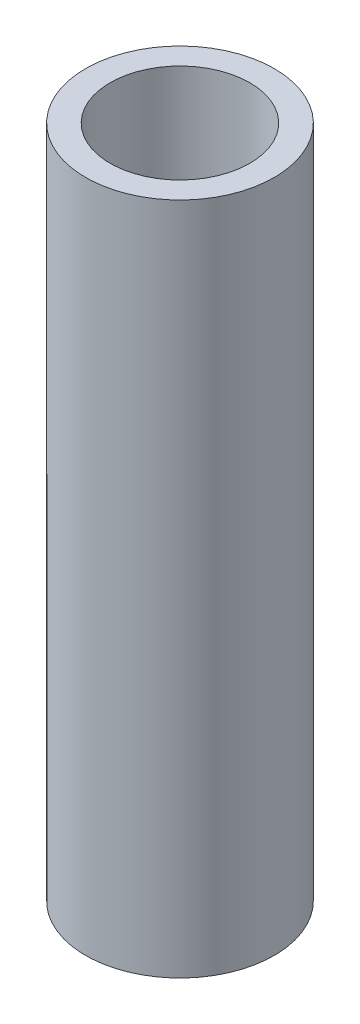
from build123d import *

# Parameters (mm, degrees)
SKETCH1_R           = 10.668
SKETCH1_R_2         = 7.8994
BOSS_EXTRUDE1_DEPTH = 76.2


with BuildPart() as part:
    # Sketch1 → Boss-Extrude1 (new body)
    with BuildSketch(Plane(origin=(0, 0, 0), x_dir=(1, 0, 0), z_dir=(0, 1, 0))):
        with Locations(Location((0, 0, 0), (0, 0, 90))):
            Circle(SKETCH1_R)
        with Locations(Location((0, 0, 0), (0, 0, 90))):
            Circle(SKETCH1_R_2, mode=Mode.SUBTRACT)
    extrude(amount=BOSS_EXTRUDE1_DEPTH)


solid = part.part
